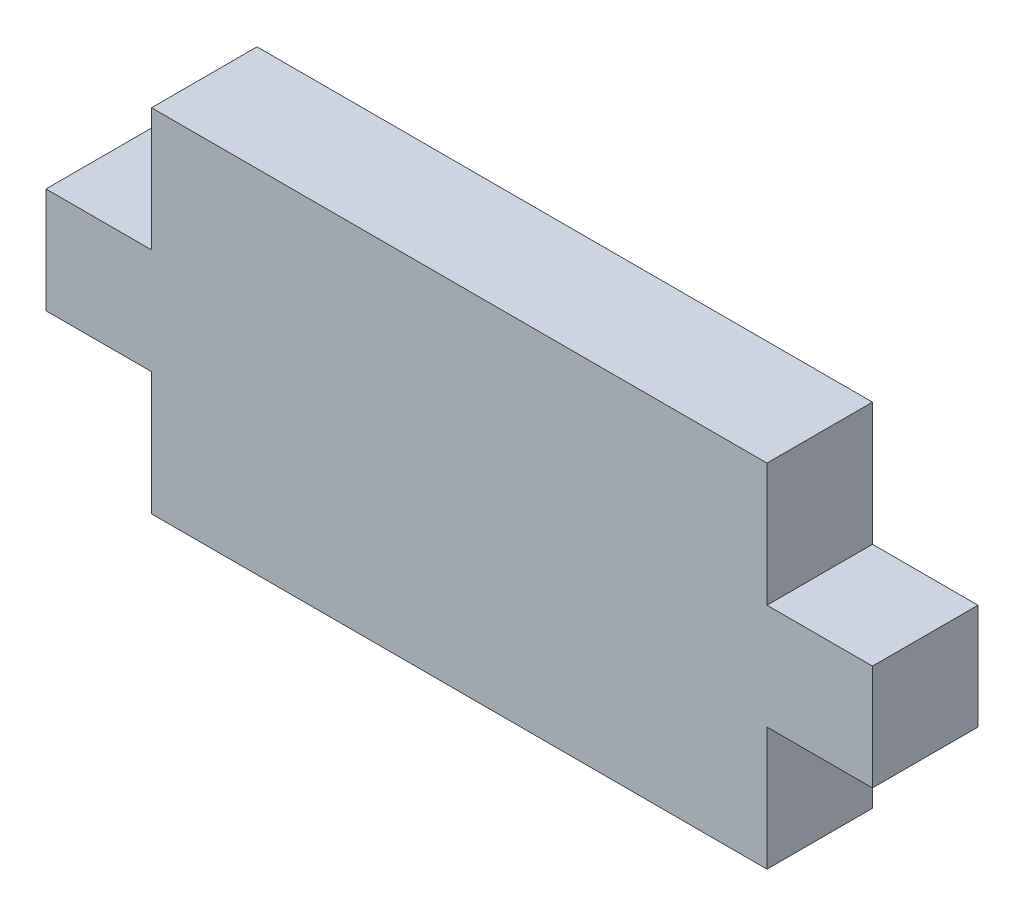
from build123d import *

# Parameters (mm, degrees)
EXTRUDE_1_DEPTH = 6


with BuildPart() as part:
    # Эскиз1 → Бобышка-Вытянуть1 (new body)
    with BuildSketch(Plane.XY):
        Polygon((-23.5, -3), (-23.5, 3), (-17.5, 3), (-17.5, 10), (17.5, 10), (17.5, 3), (23.5, 3), (23.5, -3), (17.5, -3), (17.5, -10), (-17.5, -10), (-17.5, -3), align=None)
    extrude(amount=EXTRUDE_1_DEPTH)


solid = part.part
